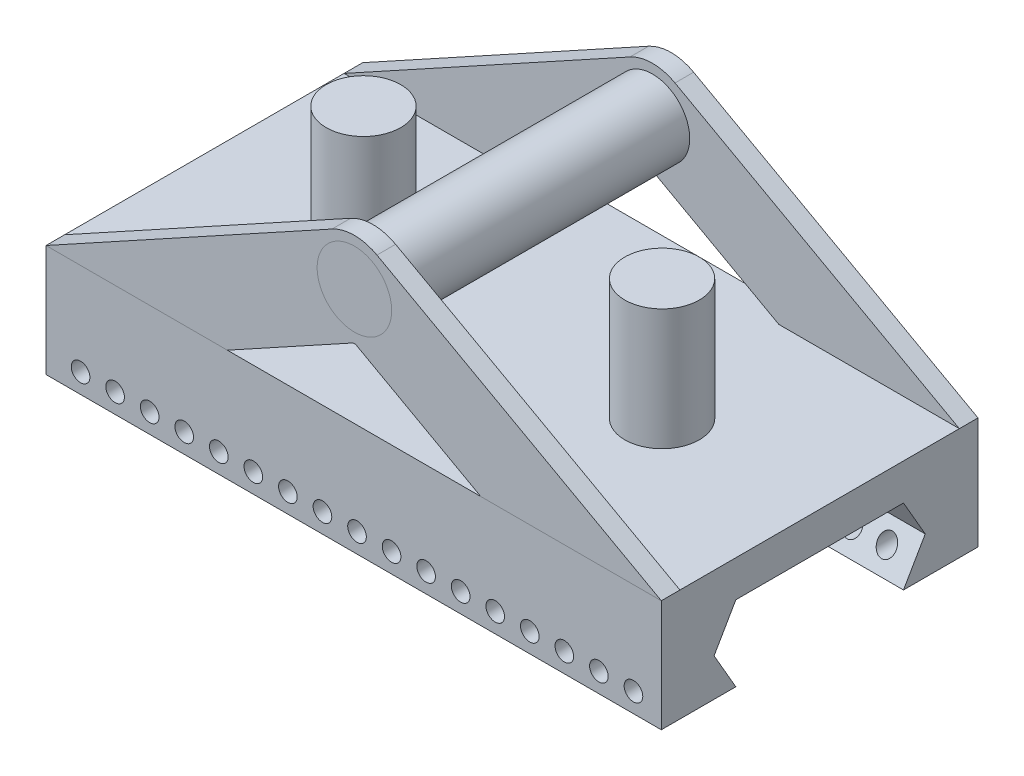
from build123d import *

# Parameters (mm, degrees)
BOSS_EXTRUDE3_DEPTH        = 13
BOSS_EXTRUDE3_DEPTH_BACK   = 3
SKETCH1_R                  = 4
BOSS_EXTRUDE3_2_DEPTH      = 13
BOSS_EXTRUDE3_2_DEPTH_BACK = 3
BOSS_EXTRUDE4_DEPTH        = 17
BOSS_EXTRUDE4_DEPTH_BACK   = 17
SKETCH4_R                  = 4
BOSS_EXTRUDE5_DEPTH        = 17
BOSS_EXTRUDE5_DEPTH_BACK   = 49.06
BOSS_EXTRUDE6_DEPTH        = 2
BOSS_EXTRUDE8_DEPTH        = 2
CUT_EXTRUDE1_DEPTH         = 55.791729303
CUT_EXTRUDE1_DEPTH_BACK    = 55.791729303
SKETCH4_3_R                = 4
FILLET1_R                  = 0.5
FILLET2_R                  = 0.5
CUT_EXTRUDE2_DEPTH         = 55.791729303
CUT_EXTRUDE2_DEPTH_BACK    = 55.791729303
SKETCH9_R                  = 1


with BuildPart() as part:
    # Sketch1 → Boss-Extrude3 (new, two sides: drawn at the far end of the back side and taken through both)
    with BuildSketch(Plane(origin=(0, 0, 0), x_dir=(1, 0, 0), z_dir=(0, 1, 0)).offset(-BOSS_EXTRUDE3_DEPTH_BACK)):
        with Locations((-31.978726334, 0)):
            Circle(SKETCH1_R)
    extrude(amount=BOSS_EXTRUDE3_DEPTH + BOSS_EXTRUDE3_DEPTH_BACK)



with BuildPart() as body_2:
    # Sketch1 → Boss-Extrude3 2 (new, two sides: drawn at the far end of the back side and taken through both)
    with BuildSketch(Plane(origin=(0, 0, 0), x_dir=(1, 0, 0), z_dir=(0, 1, 0)).offset(-BOSS_EXTRUDE3_2_DEPTH_BACK)):
        with Locations((0.081273666, 0)):
            Circle(SKETCH1_R)
    extrude(amount=BOSS_EXTRUDE3_2_DEPTH + BOSS_EXTRUDE3_2_DEPTH_BACK)


with BuildPart() as body_3:
    # Sketch4 → Boss-Extrude4 (new, two sides: drawn at the far end of the back side and taken through both)
    with BuildSketch(Plane.XY.offset(-BOSS_EXTRUDE4_DEPTH_BACK)):
        with Locations((-15.948726334, 12.5)):
            Circle(SKETCH4_R)
    extrude(amount=BOSS_EXTRUDE4_DEPTH + BOSS_EXTRUDE4_DEPTH_BACK)


with BuildPart() as part_1:
    add(part.part)

    add(body_2.part)  # Boss-Extrude5 merges body 2
    # Sketch3 → Boss-Extrude5 (add, two sides: drawn at the far end of the back side and taken through both)
    with BuildSketch(Plane(origin=(0, 0, 0), x_dir=(0, 0, -1), z_dir=(1, 0, 0)).offset(-BOSS_EXTRUDE5_DEPTH_BACK)):
        Polygon((-17, 0), (-17, -12), (-9, -12), (-11.335, -7.955661364), (-9, -3.911322729), (9, -3.911322729), (11.335, -7.955661364), (9, -12), (17, -12), (17, 0), align=None)
    extrude(amount=BOSS_EXTRUDE5_DEPTH + BOSS_EXTRUDE5_DEPTH_BACK)

    # Sketch8 → Boss-Extrude8 (add)
    with BuildSketch(Plane(origin=(0, 0, -17), x_dir=(-1, 0, 0), z_dir=(0, 0, -1))):
        with BuildLine():
            Line((13.529834398, 16.875952674), (-17, 0))
            Line((-17, 0), (2.380677027, 0))
            Line((2.380677027, 0), (15.948726334, 7.5))
            Line((15.948726334, 7.5), (29.589003202, 0))
            Line((29.589003202, 0), (49.06, 0))
            Line((49.06, 0), (18.357789294, 16.881371435))
            ThreePointArc((18.357789294, 16.881371435), (15.943114477, 17.499996851), (13.529834398, 16.875952674))
        make_face()
    extrude(amount=-BOSS_EXTRUDE8_DEPTH)


with BuildPart() as body_3_2:
    # Sketch6 → Boss-Extrude6 (new body)
    with BuildSketch(Plane.XY.offset(17)):
        with BuildLine():
            Line((-18.357789294, 16.881371435), (-49.06, 0))
            Line((-49.06, 0), (-29.589003202, 0))
            Line((-29.589003202, 0), (-15.948726334, 7.5))
            Line((-15.948726334, 7.5), (-2.380677027, 0))
            Line((-2.380677027, 0), (17, 0))
            Line((17, 0), (-13.529834398, 16.875952674))
            ThreePointArc((-13.529834398, 16.875952674), (-15.943114477, 17.499996851), (-18.357789294, 16.881371435))
        make_face()
    extrude(amount=-BOSS_EXTRUDE6_DEPTH)


with BuildPart() as cut_extrude1_tool:
    # Sketch4<3> → Cut-Extrude1 (new, two sides: drawn at the far end of the back side and taken through both)
    with BuildSketch(Plane.XY.offset(-CUT_EXTRUDE1_DEPTH_BACK)):
        with Locations((-15.948726334, 12.5)):
            Circle(SKETCH4_3_R)
    extrude(amount=CUT_EXTRUDE1_DEPTH + CUT_EXTRUDE1_DEPTH_BACK)


with BuildPart() as body_3_2_1:
    add(body_3_2.part)

    # Cut-Extrude1: cut by cut_extrude1_tool
    add(cut_extrude1_tool.part, mode=Mode.SUBTRACT)

    # Fillet2
    fillet2_edges = [body_3_2_1.edges().sort_by_distance(p)[0] for p in [
        (-15.948726334, 7.5, 16),
    ]]
    fillet(fillet2_edges, radius=FILLET2_R)


with BuildPart() as part_2:
    add(part_1.part)

    # Cut-Extrude1: cut by cut_extrude1_tool
    add(cut_extrude1_tool.part, mode=Mode.SUBTRACT)

    # Fillet1
    fillet1_edges = [part_2.edges().sort_by_distance(p)[0] for p in [
        (-15.948726334, 7.5, -16),
    ]]
    fillet(fillet1_edges, radius=FILLET1_R)

    # Sketch9 → Cut-Extrude2 (cut, two sides: drawn at the far end of the back side and taken through both)
    with BuildSketch(Plane.XY.offset(-CUT_EXTRUDE2_DEPTH_BACK)):
        with Locations((-45.35, -9.9)):
            Circle(SKETCH9_R)
        with Locations((-37.93, -9.9)):
            Circle(SKETCH9_R)
        with Locations((-23.09, -9.9)):
            Circle(SKETCH9_R)
        with Locations((-15.67, -9.9)):
            Circle(SKETCH9_R)
        with Locations((-41.64, -9.9)):
            Circle(SKETCH9_R)
        with Locations((-30.51, -9.9)):
            Circle(SKETCH9_R)
        with Locations((-19.38, -9.9)):
            Circle(SKETCH9_R)
        with Locations((-34.22, -9.9)):
            Circle(SKETCH9_R)
        with Locations((-26.8, -9.9)):
            Circle(SKETCH9_R)
        with Locations((-11.96, -9.9)):
            Circle(SKETCH9_R)
        with Locations((-8.25, -9.9)):
            Circle(SKETCH9_R)
        with Locations((-4.54, -9.9)):
            Circle(SKETCH9_R)
        with Locations((-0.83, -9.9)):
            Circle(SKETCH9_R)
        with Locations((2.88, -9.9)):
            Circle(SKETCH9_R)
        with Locations((6.59, -9.9)):
            Circle(SKETCH9_R)
        with Locations((10.3, -9.9)):
            Circle(SKETCH9_R)
        with Locations((14.01, -9.9)):
            Circle(SKETCH9_R)
    extrude(amount=CUT_EXTRUDE2_DEPTH + CUT_EXTRUDE2_DEPTH_BACK, mode=Mode.SUBTRACT)


solid = Compound([body_3.part, body_3_2_1.part, part_2.part])
